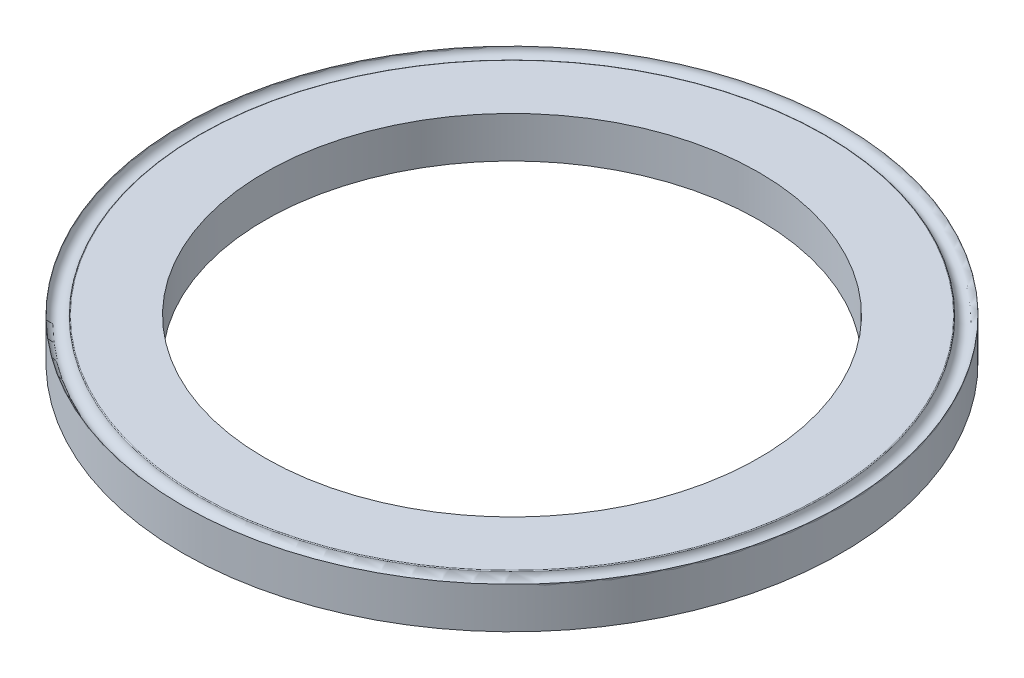
from build123d import *

# Parameters (mm, degrees)
DIAPROFILES_R    = 4
DIAPROFILES_R_2  = 3
DIAPROFILE_DEPTH = 0.25


with BuildPart() as part:
    # DiaProfileS → DiaProfile (new, symmetric)
    with BuildSketch(Plane(origin=(0, 0, 0), x_dir=(1, 0, 0), z_dir=(0, 1, 0))):
        with Locations(Location((0, 0, 0), (0, 0, 270))):
            Circle(DIAPROFILES_R)
        with Locations(Location((0, 0, 0), (0, 0, 270))):
            Circle(DIAPROFILES_R_2, mode=Mode.SUBTRACT)
    extrude(amount=DIAPROFILE_DEPTH, both=True)

    # CrimpS → Crimp (revolve, cut)
    with BuildSketch(Plane.XY, mode=Mode.PRIVATE) as crimp_sk:
        with BuildLine():
            Line((-4, 0.25), (-3.790455488, 0.25))
            ThreePointArc((-3.790455488, 0.25), (-3.797197487, 0.247385489), (-3.80041408, 0.240909091))
            ThreePointArc((-3.80041408, 0.240909091), (-3.904550167, 0.150103574), (-4, 0.25))
        make_face()
    revolve(crimp_sk.sketch.rotate(Axis((0, 0.25, 0), (0, -1, 0)), 270), axis=Axis((0, 0.25, 0), (0, -1, 0)), mode=Mode.SUBTRACT)


solid = part.part
